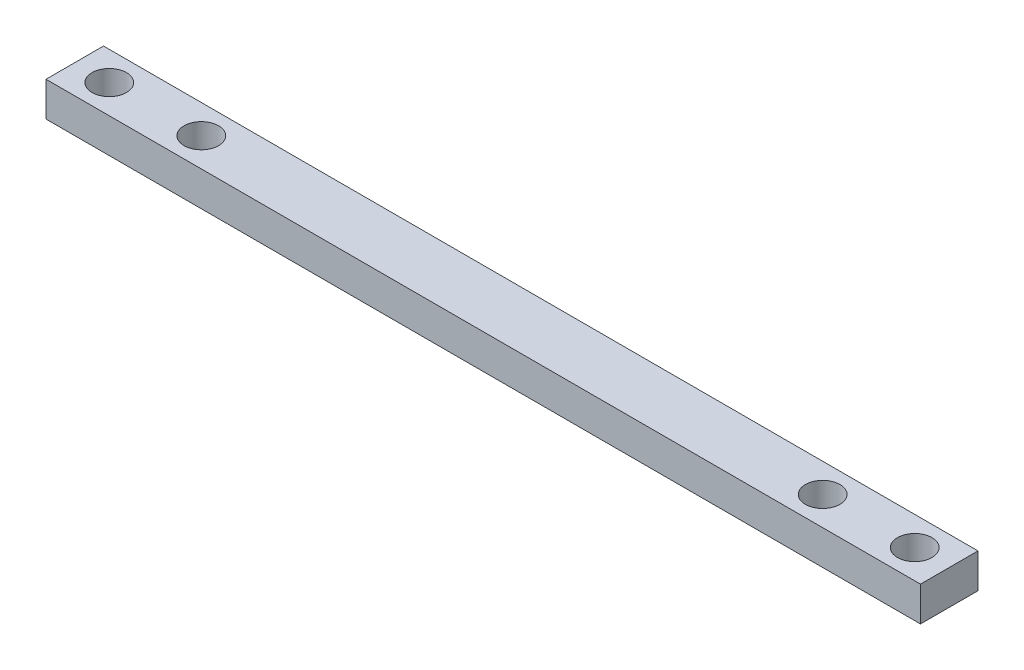
from build123d import *

# Parameters (mm, degrees)
SKETCH1_W           = 76
SKETCH1_H           = 5
SKETCH1_R           = 1.5
BOSS_EXTRUDE1_DEPTH = 3


with BuildPart() as part:
    # Sketch1 → Boss-Extrude1 (new body)
    with BuildSketch(Plane(origin=(0, 0, 0), x_dir=(1, 0, 0), z_dir=(0, 1, 0))):
        Rectangle(SKETCH1_W, SKETCH1_H)
        with Locations(Location((-35, 0, 0), (0, 0, 270))):
            Circle(SKETCH1_R, mode=Mode.SUBTRACT)
        with Locations(Location((-27, 0, 0), (0, 0, 270))):
            Circle(SKETCH1_R, mode=Mode.SUBTRACT)
        with Locations(Location((35, 0, 0), (0, 0, 90))):
            Circle(SKETCH1_R, mode=Mode.SUBTRACT)
        with Locations(Location((27, 0, 0), (0, 0, 90))):
            Circle(SKETCH1_R, mode=Mode.SUBTRACT)
    extrude(amount=BOSS_EXTRUDE1_DEPTH)


solid = part.part
